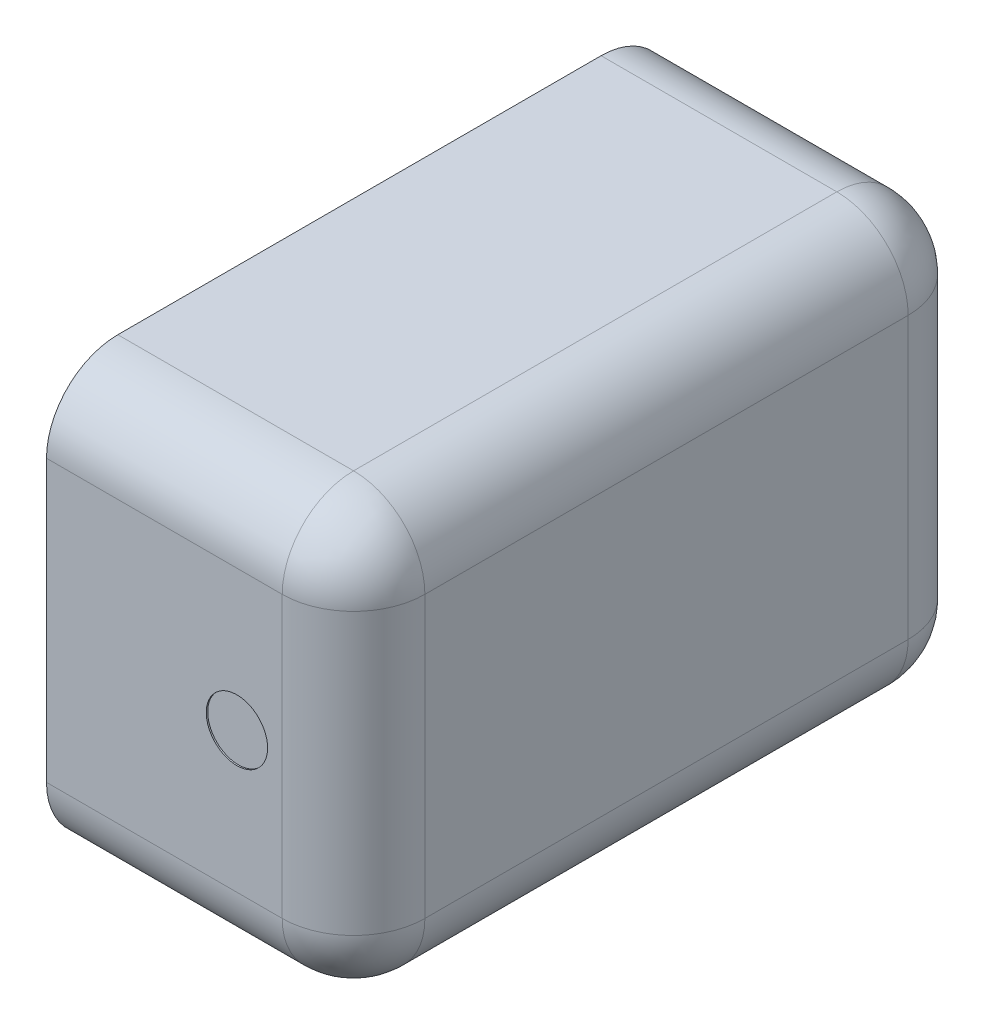
from build123d import *

# Parameters (mm, degrees)
SKETCH1_W           = 87.75
SKETCH1_H           = 59.35
BOSS_EXTRUDE1_DEPTH = 43.05
FILLET1_R           = 10
SKETCH2_R           = 4.3
CUT_EXTRUDE1_DEPTH  = 0.2


with BuildPart() as part:
    # Sketch1 → Boss-Extrude1 (new body)
    with BuildSketch(Plane(origin=(0, 0, 0), x_dir=(0, 0, -1), z_dir=(1, 0, 0))):
        Rectangle(SKETCH1_W, SKETCH1_H)
    extrude(amount=BOSS_EXTRUDE1_DEPTH)

    # Fillet1
    fillet1_edges = [part.edges().sort_by_distance(p)[0] for p in [
        (21.525, 29.675, -43.875),
        (21.525, -29.675, -43.875),
        (43.05, -29.675, 0),
        (43.05, 0, -43.875),
        (43.05, 29.675, 0),
        (21.525, 29.675, 43.875),
        (43.05, 0, 43.875),
        (21.525, -29.675, 43.875),
    ]]
    fillet(fillet1_edges, radius=FILLET1_R)

    # Sketch2 → Cut-Extrude1 (cut)
    with BuildSketch(Plane.XY.offset(43.875)):
        with Locations((26.7, 0)):
            Circle(SKETCH2_R)
    extrude(amount=-CUT_EXTRUDE1_DEPTH, mode=Mode.SUBTRACT)


solid = part.part
